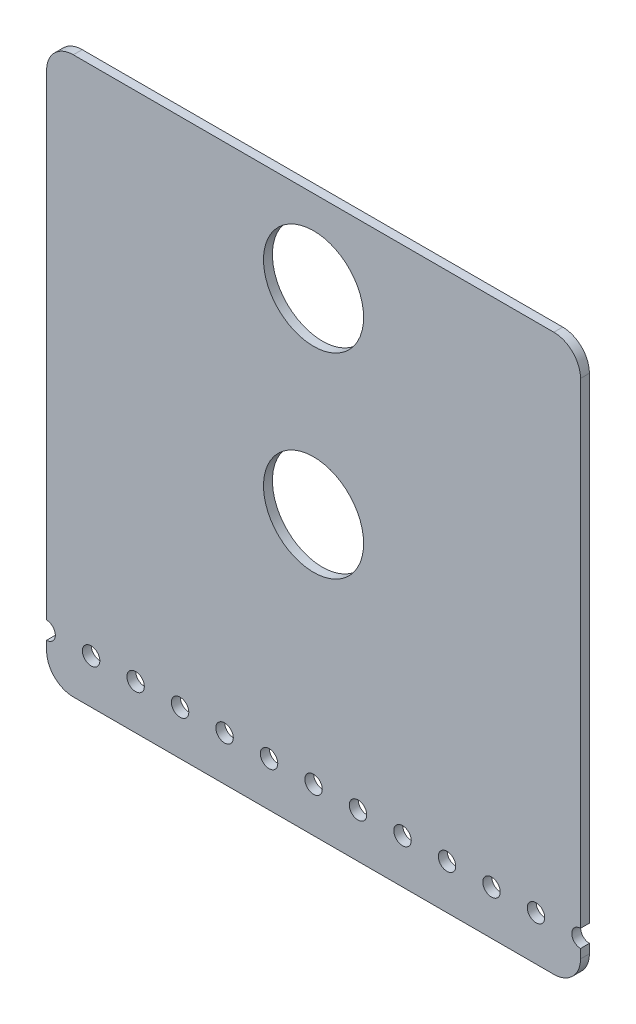
from build123d import *

# Parameters (mm, degrees)
SKETCH1_R           = 14.2875
SKETCH1_R_2         = 2.4892
BOSS_EXTRUDE1_DEPTH = 2.54
FILLET1_R           = 7.62


with BuildPart() as part:
    # Sketch1 → Boss-Extrude1 (new body)
    with BuildSketch(Plane.XY):
        with BuildLine():
            Line((-76.2, -15.1892), (-76.2, -25.4))
            Line((-76.2, -25.4), (76.2, -25.4))
            Line((76.2, -25.4), (76.2, -15.1892))
            ThreePointArc((76.2, -15.1892), (73.7108, -12.7), (76.2, -10.2108))
            Line((76.2, -10.2108), (76.2, 133.35))
            Line((76.2, 133.35), (-76.2, 133.35))
            Line((-76.2, 133.35), (-76.2, -10.2108))
            ThreePointArc((-76.2, -10.2108), (-73.7108, -12.7), (-76.2, -15.1892))
        make_face()
        with Locations((0, 53.975)):
            Circle(SKETCH1_R, mode=Mode.SUBTRACT)
        with Locations((-63.5, -12.7)):
            Circle(SKETCH1_R_2, mode=Mode.SUBTRACT)
        with Locations((-50.8, -12.7)):
            Circle(SKETCH1_R_2, mode=Mode.SUBTRACT)
        with Locations((-38.1, -12.7)):
            Circle(SKETCH1_R_2, mode=Mode.SUBTRACT)
        with Locations((-25.4, -12.7)):
            Circle(SKETCH1_R_2, mode=Mode.SUBTRACT)
        with Locations((-12.7, -12.7)):
            Circle(SKETCH1_R_2, mode=Mode.SUBTRACT)
        with Locations((0, -12.7)):
            Circle(SKETCH1_R_2, mode=Mode.SUBTRACT)
        with Locations((12.7, -12.7)):
            Circle(SKETCH1_R_2, mode=Mode.SUBTRACT)
        with Locations((25.4, -12.7)):
            Circle(SKETCH1_R_2, mode=Mode.SUBTRACT)
        with Locations((38.1, -12.7)):
            Circle(SKETCH1_R_2, mode=Mode.SUBTRACT)
        with Locations((50.8, -12.7)):
            Circle(SKETCH1_R_2, mode=Mode.SUBTRACT)
        with Locations((63.5, -12.7)):
            Circle(SKETCH1_R_2, mode=Mode.SUBTRACT)
        with Locations((0, 109.855)):
            Circle(SKETCH1_R, mode=Mode.SUBTRACT)
    extrude(amount=BOSS_EXTRUDE1_DEPTH)

    # Fillet1
    fillet1_edges = [part.edges().sort_by_distance(p)[0] for p in [
        (76.2, -25.4, 1.27),
        (-76.2, -25.4, 1.27),
        (-76.2, 133.35, 1.27),
        (76.2, 133.35, 1.27),
    ]]
    fillet(fillet1_edges, radius=FILLET1_R)


solid = part.part
